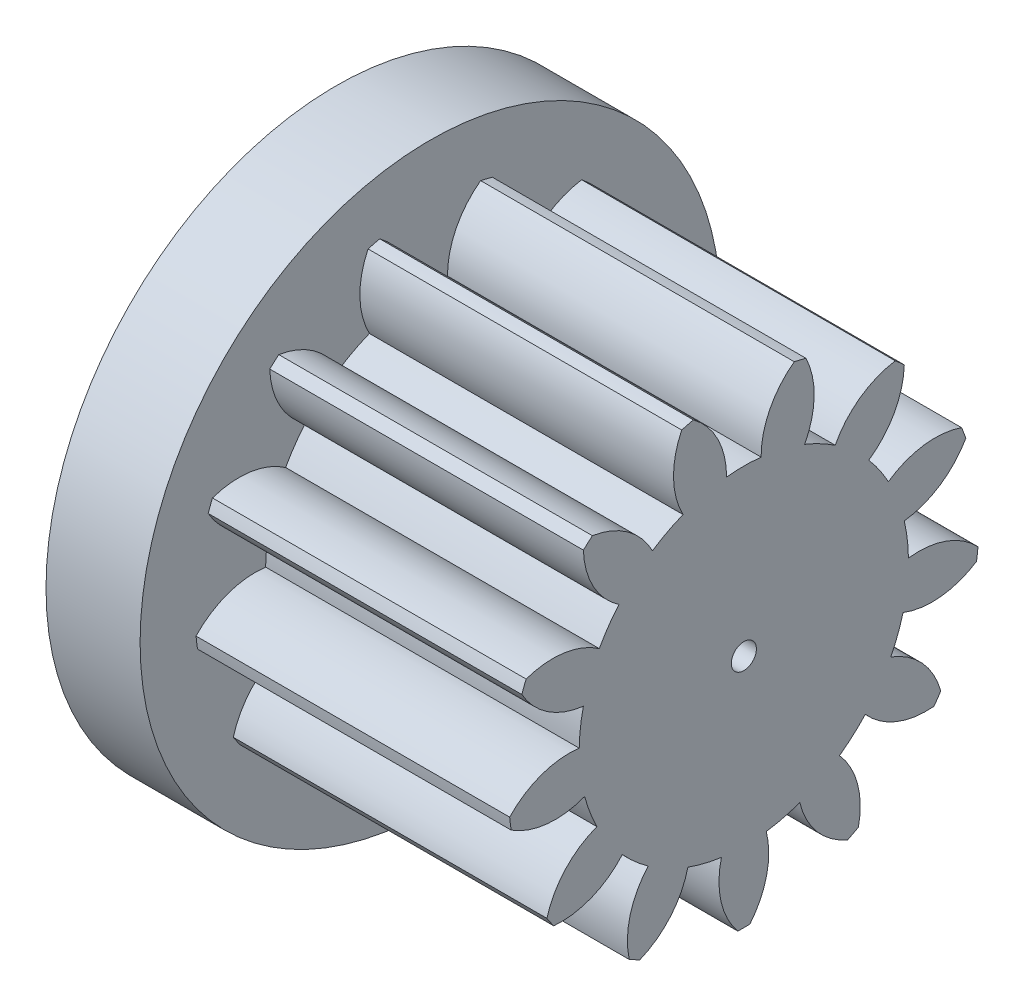
from build123d import *

# Parameters (mm, degrees)
BASPROSKE_W         = 10
BASPROSKE_H         = 7.5
TOOTHCUT_DEPTH      = 15.577379737
TEETHCUTS_COUNT     = 13
TEETHCUTS_ANGLE     = 332.307692308
BORSKE_R            = 0.4
BORE_DEPTH          = 50.0000508
SKETCH1_R           = 9.25
BOSS_EXTRUDE1_DEPTH = 3
SKETCH6_R           = 0.5
CUT_EXTRUDE1_DEPTH  = 2
CIRPATTERN1_COUNT   = 6


with BuildPart() as part:
    # BasProSke → Base-Revolve (revolve)
    with BuildSketch(Plane(origin=(0, 0, 0), x_dir=(1, 0, 0), z_dir=(0, 1, 0)), mode=Mode.PRIVATE) as base_revolve_sk:
        with Locations((5, 3.75)):
            Rectangle(BASPROSKE_W, BASPROSKE_H)
    revolve(base_revolve_sk.sketch.rotate(Axis((-10, 0, 0), (1, 0, 0)), 180), axis=Axis((-10, 0, 0), (1, 0, 0)))

    # TooCutSke → ToothCut (cut, through all)
    with BuildSketch(Plane(origin=(0, 0, 0), x_dir=(0, 0, -1), z_dir=(1, 0, 0))):
        with BuildLine():
            ThreePointArc((0.550489643, 5.220053846), (0, 5.249), (-0.550489643, 5.220053846))
            ThreePointArc((-0.550489643, 5.220053846), (-0.834571714, 6.414617604), (-1.635166801, 7.345602405))
            ThreePointArc((-1.635166801, 7.345602405), (0, 7.5254), (1.635166801, 7.345602405))
            ThreePointArc((1.635166801, 7.345602405), (0.834571714, 6.414617604), (0.550489643, 5.220053846))
        make_face()
    toothcut = extrude(amount=TOOTHCUT_DEPTH, mode=Mode.SUBTRACT)

    # TeethCuts: ToothCut ×13 about axis
    teethcuts_axis = Axis((-10, 0, 0), (1, 0, 0))
    for i in range(1, TEETHCUTS_COUNT):
        add(toothcut.rotate(teethcuts_axis, i * TEETHCUTS_ANGLE / (TEETHCUTS_COUNT - 1)), mode=Mode.SUBTRACT)

    # BorSke → Bore (cut, symmetric)
    with BuildSketch(Plane(origin=(0, 0, 0), x_dir=(0, 0, -1), z_dir=(1, 0, 0))):
        with Locations(Location((0, 0, 0), (0, 0, 180))):
            Circle(BORSKE_R)
    extrude(amount=BORE_DEPTH, both=True, mode=Mode.SUBTRACT)

    # Sketch1 → Boss-Extrude1 (add)
    with BuildSketch(Plane.ZY):
        Circle(SKETCH1_R)
    extrude(amount=BOSS_EXTRUDE1_DEPTH)

    # Sketch6 → Cut-Extrude1 (cut)
    with BuildSketch(Plane.ZY.offset(3)):
        with Locations((-8.01665008, -1.724332186)):
            Circle(SKETCH6_R)
    cut_extrude1 = extrude(amount=-CUT_EXTRUDE1_DEPTH, mode=Mode.SUBTRACT)

    # CirPattern1: Cut-Extrude1 ×6 about axis
    cirpattern1_axis = Axis((0, 0, 0), (1, 0, 0))
    for i in range(1, CIRPATTERN1_COUNT):
        add(cut_extrude1.rotate(cirpattern1_axis, i * 360 / CIRPATTERN1_COUNT), mode=Mode.SUBTRACT)


solid = part.part
